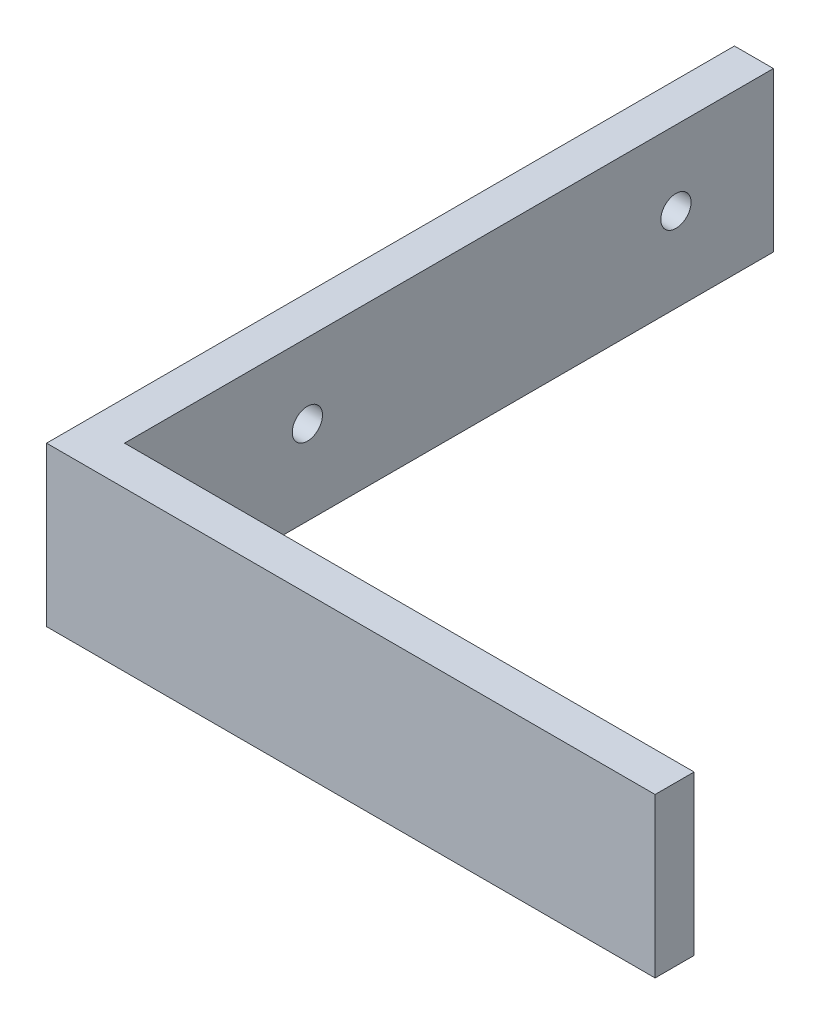
from build123d import *

# Parameters (mm, degrees)
SKETCH_1_W      = 62.4134
SKETCH_1_H      = 16.3
EXTRUDE_1_DEPTH = 4
SKETCH_3_W      = 70.55
SKETCH_3_H      = 16.3
SKETCH_3_R      = 1.55
EXTRUDE_3_DEPTH = 4


with BuildPart() as part:
    # 草图1 → 凸台-拉伸1 (new body)
    with BuildSketch(Plane.XY):
        with Locations((-3.9433, 0)):
            Rectangle(SKETCH_1_W, SKETCH_1_H)
    extrude(amount=EXTRUDE_1_DEPTH)

    # 草图3 → 凸台-拉伸3 (add)
    with BuildSketch(Plane.ZY.offset(35.15)):
        with Locations((-31.275, 0)):
            Rectangle(SKETCH_3_W, SKETCH_3_H)
        with Locations((-56.55, 0.5)):
            Circle(SKETCH_3_R, mode=Mode.SUBTRACT)
        with Locations((-18.75, 0.5)):
            Circle(SKETCH_3_R, mode=Mode.SUBTRACT)
    extrude(amount=-EXTRUDE_3_DEPTH)


solid = part.part
